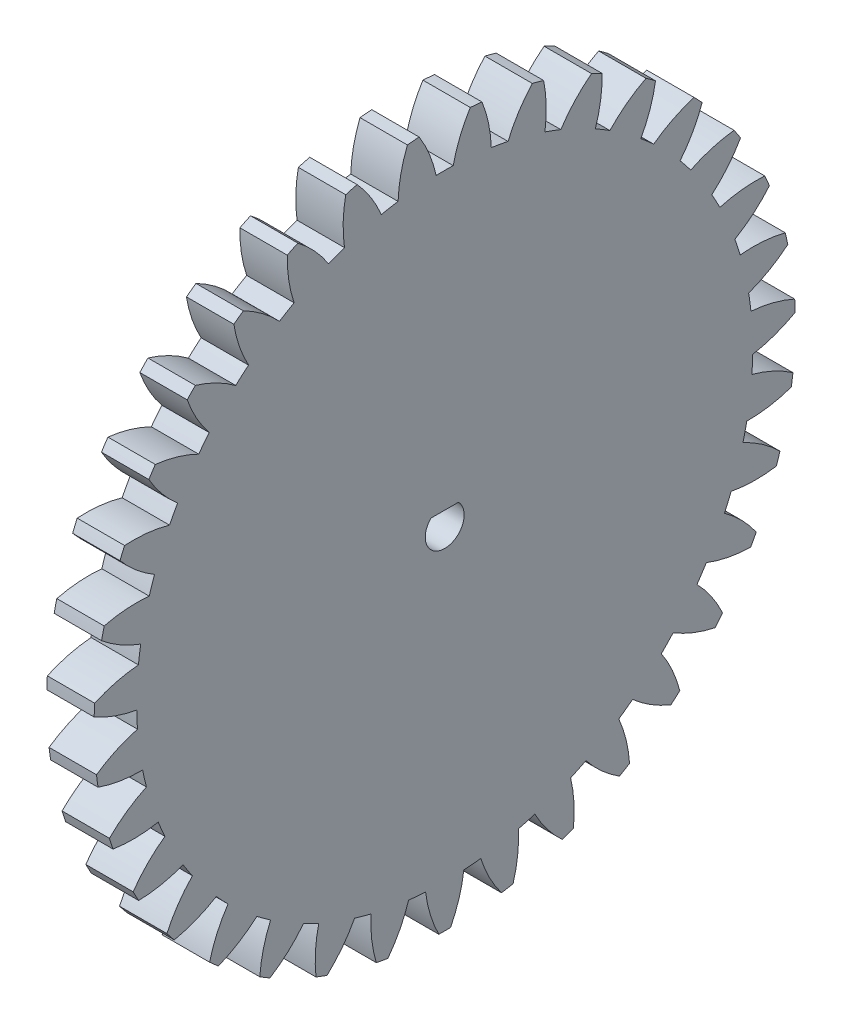
from build123d import *

# Parameters (mm, degrees)
BASPROSKE_W        = 5
BASPROSKE_H        = 37
TOOTHCUT_DEPTH     = 53.564246404
TEETHCUTS_COUNT    = 35
TEETHCUTS_ANGLE    = 349.714285714
BORSKE_R           = 1
BORE_DEPTH         = 50.0000508
CUT_EXTRUDE1_DEPTH = 10


with BuildPart() as part:
    # BasProSke → Base-Revolve (revolve)
    with BuildSketch(Plane(origin=(0, 0, 0), x_dir=(1, 0, 0), z_dir=(0, 1, 0)), mode=Mode.PRIVATE) as base_revolve_sk:
        with Locations((2.5, 18.5)):
            Rectangle(BASPROSKE_W, BASPROSKE_H)
    revolve(base_revolve_sk.sketch.rotate(Axis((-10, 0, 0), (1, 0, 0)), 180), axis=Axis((-10, 0, 0), (1, 0, 0)))

    # TooCutSke → ToothCut (cut, through all)
    with BuildSketch(Plane(origin=(0, 0, 0), x_dir=(0, 0, -1), z_dir=(1, 0, 0))):
        with BuildLine():
            ThreePointArc((0.898309596, 32.486582474), (0, 32.499), (-0.898309596, 32.486582474))
            ThreePointArc((-0.898309596, 32.486582474), (-1.614633767, 34.784521638), (-2.713989627, 36.925797289))
            ThreePointArc((-2.713989627, 36.925797289), (0, 37.0254), (2.713989627, 36.925797289))
            ThreePointArc((2.713989627, 36.925797289), (1.614633767, 34.784521638), (0.898309596, 32.486582474))
        make_face()
    toothcut = extrude(amount=TOOTHCUT_DEPTH, mode=Mode.SUBTRACT)

    # TeethCuts: ToothCut ×35 about axis
    teethcuts_axis = Axis((-10, 0, 0), (1, 0, 0))
    for i in range(1, TEETHCUTS_COUNT):
        add(toothcut.rotate(teethcuts_axis, i * TEETHCUTS_ANGLE / (TEETHCUTS_COUNT - 1)), mode=Mode.SUBTRACT)

    # BorSke → Bore (cut, symmetric)
    with BuildSketch(Plane(origin=(0, 0, 0), x_dir=(0, 0, -1), z_dir=(1, 0, 0))):
        with Locations(Location((0, 0, 0), (0, 0, 180))):
            Circle(BORSKE_R)
    extrude(amount=BORE_DEPTH, both=True, mode=Mode.SUBTRACT)

    # Sketch1 → Cut-Extrude1 (cut)
    with BuildSketch(Plane(origin=(5, 0, 0), x_dir=(0, 0, -1), z_dir=(1, 0, 0))):
        with BuildLine():
            Line((-1.449137675, 1.45), (1.449137675, 1.45))
            ThreePointArc((1.449137675, 1.45), (0, -2.05), (-1.449137675, 1.45))
        make_face()
    extrude(amount=-CUT_EXTRUDE1_DEPTH, mode=Mode.SUBTRACT)


solid = part.part
